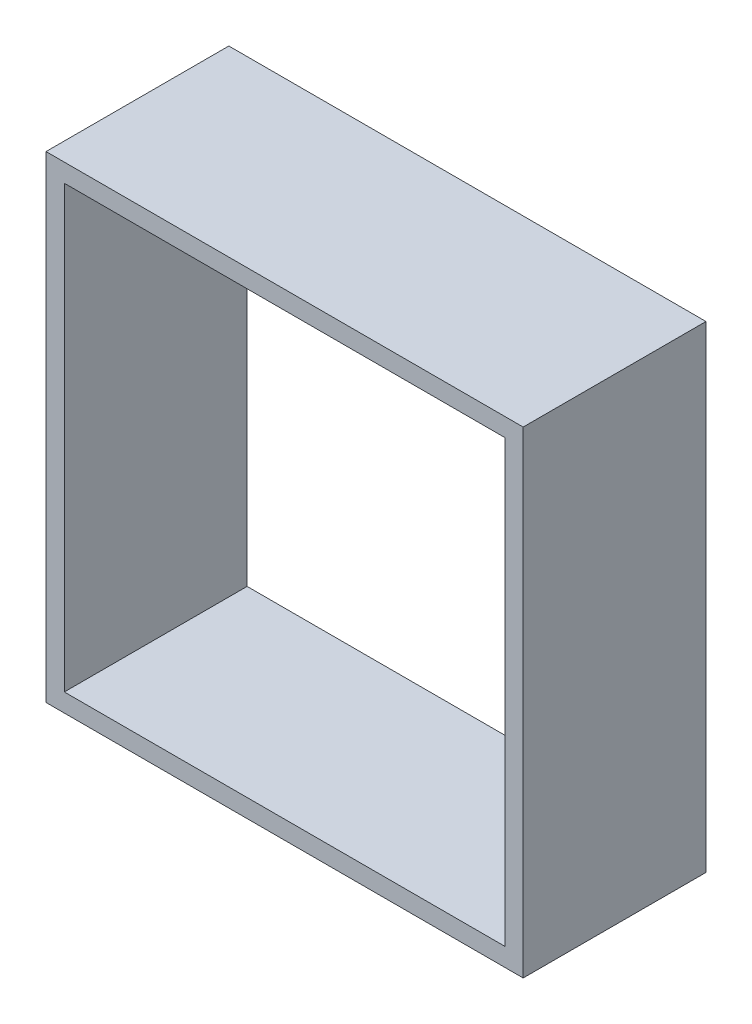
from build123d import *

# Parameters (mm, degrees)
SKETCH1_W           = 13.05
SKETCH1_H           = 13.05
SKETCH1_W_2         = 12.05
SKETCH1_H_2         = 12.05
BOSS_EXTRUDE1_DEPTH = 5


with BuildPart() as part:
    # Sketch1 → Boss-Extrude1 (new body)
    with BuildSketch(Plane.XY):
        Rectangle(SKETCH1_W, SKETCH1_H)
        Rectangle(SKETCH1_W_2, SKETCH1_H_2, mode=Mode.SUBTRACT)
    extrude(amount=BOSS_EXTRUDE1_DEPTH)


solid = part.part
